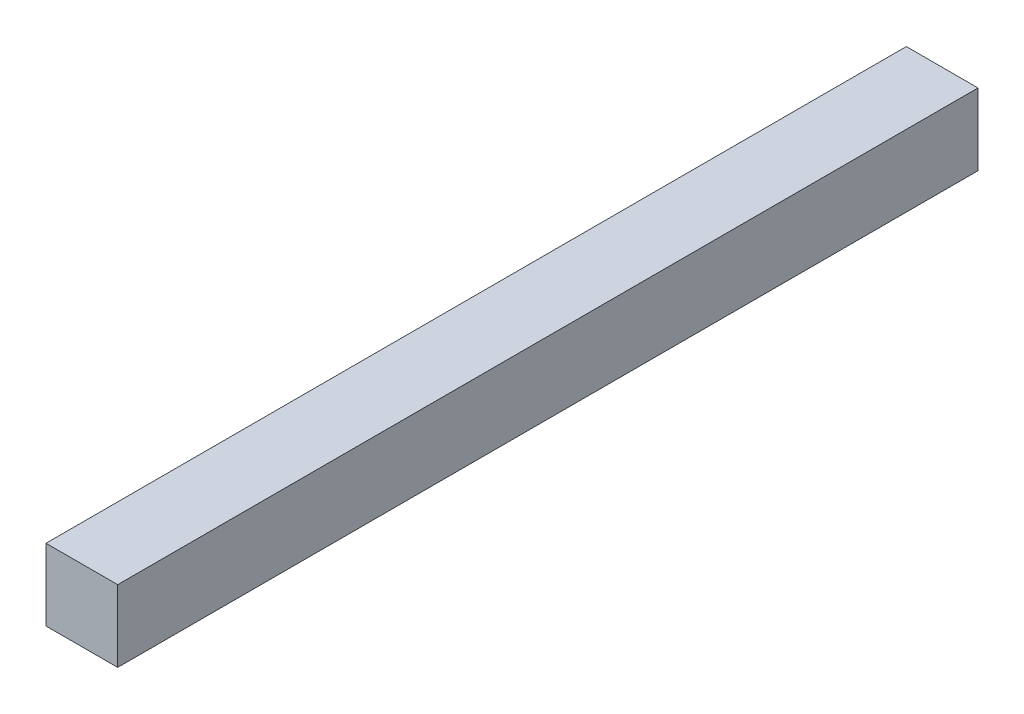
from build123d import *

# Parameters (mm, degrees)
SKETCH1_W           = 50
SKETCH1_H           = 50
BOSS_EXTRUDE1_DEPTH = 600


with BuildPart() as part:
    # Sketch1 → Boss-Extrude1 (new body)
    with BuildSketch(Plane.XY):
        with Locations((-41.448171192, -1.018862214)):
            Rectangle(SKETCH1_W, SKETCH1_H)
    extrude(amount=BOSS_EXTRUDE1_DEPTH)


solid = part.part
